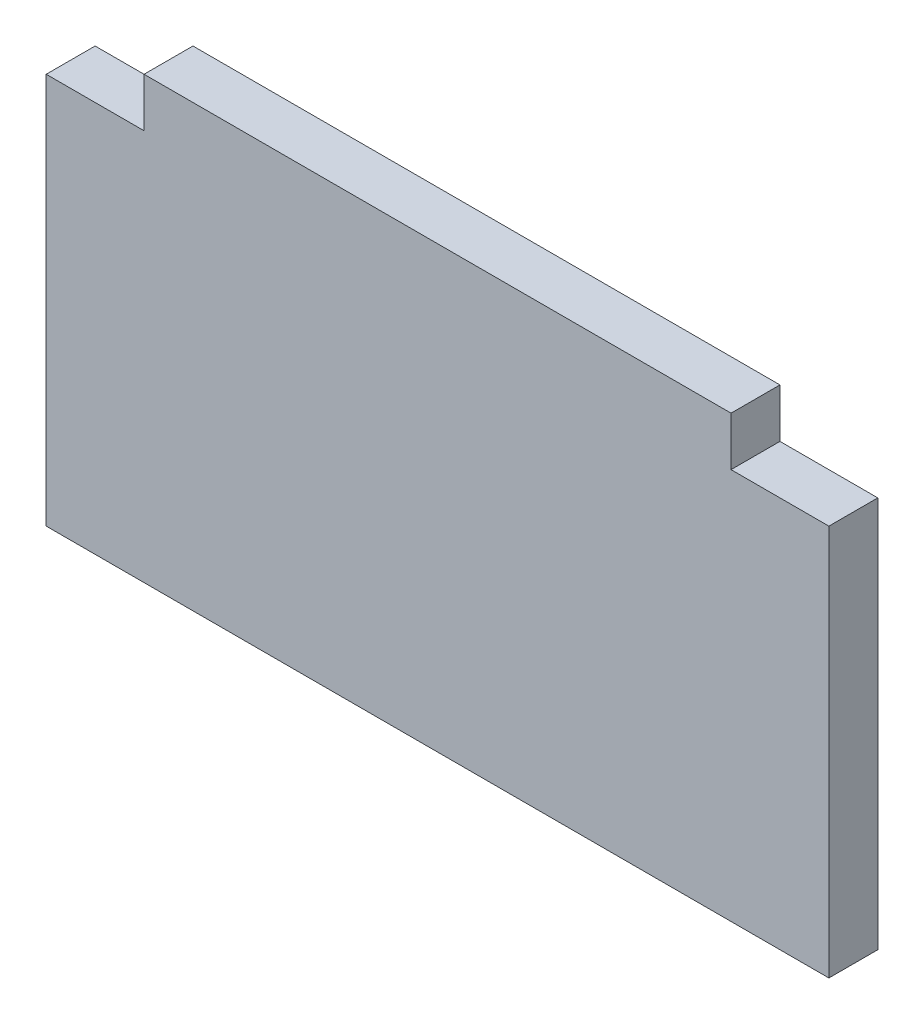
from build123d import *

# Parameters (mm, degrees)
SKETCH1_W           = 101.6
SKETCH1_H           = 57.15
BOSS_EXTRUDE1_DEPTH = 3.175
SKETCH2_W           = 12.7
SKETCH2_H           = 6.35
CUT_EXTRUDE1_DEPTH  = 59.630138368


with BuildPart() as part:
    # Sketch1 → Boss-Extrude1 (new, symmetric)
    with BuildSketch(Plane.XY):
        Rectangle(SKETCH1_W, SKETCH1_H)
    extrude(amount=BOSS_EXTRUDE1_DEPTH, both=True)

    # Sketch2 → Cut-Extrude1 (cut, through all)
    with BuildSketch(Plane.XY.offset(3.175)):
        with Locations((-44.45, 25.4)):
            Rectangle(SKETCH2_W, SKETCH2_H)
    cut_extrude1 = extrude(amount=-CUT_EXTRUDE1_DEPTH, mode=Mode.SUBTRACT)

    # Mirror1: Cut-Extrude1 across plane
    add(cut_extrude1.mirror(Plane(origin=(0, 0, 0), x_dir=(0, 0, 1), z_dir=(1, 0, 0))), mode=Mode.SUBTRACT)


solid = part.part
